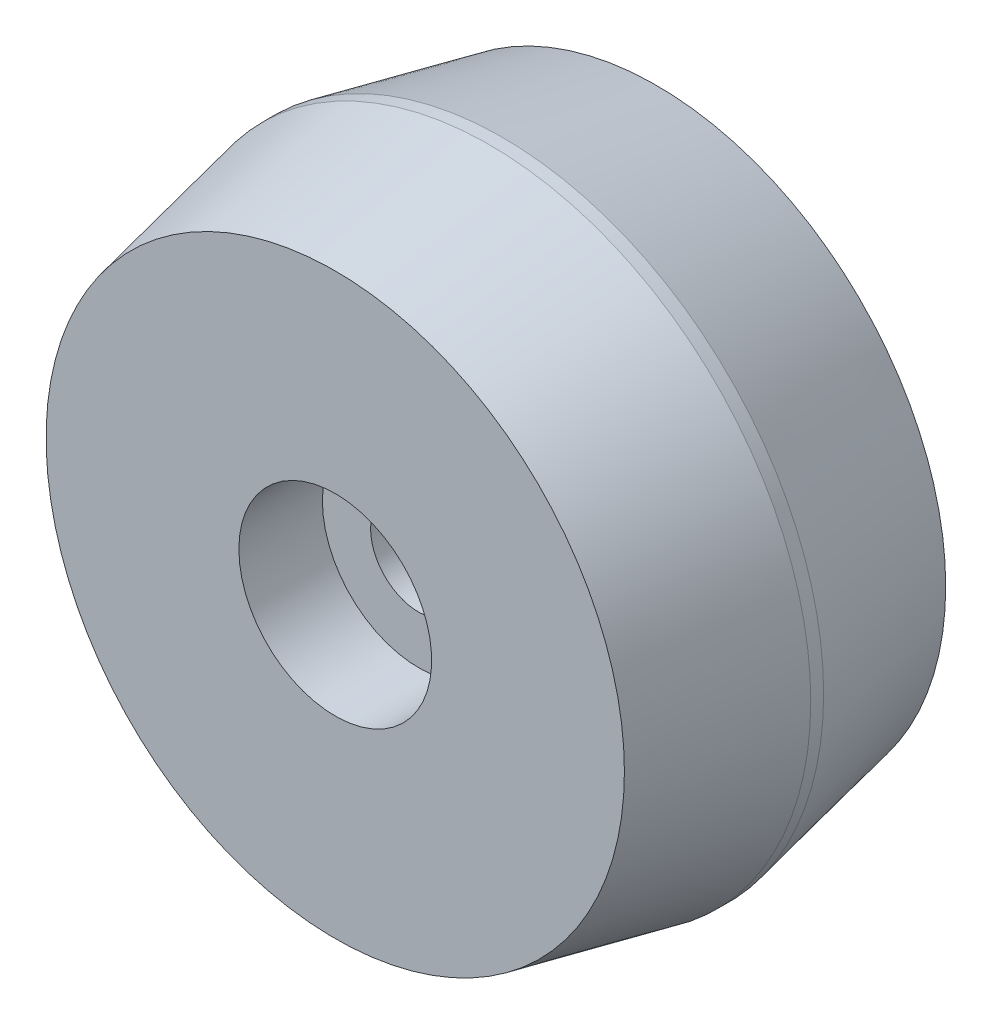
from build123d import *

# Parameters (mm, degrees)
SKETCH_1_R          = 10
EXTRUDE_1_DEPTH     = 10
CHAMFER_1_SIZE      = 1
CHAMFER_1_SIZE2     = 4.8
CHAMFER_2_SIZE      = 4.8
CHAMFER_2_SIZE2     = 1
SKETCH_2_R          = 3
CUT_EXTRUDE_1_DEPTH = 2.6
CUT_EXTRUDE_START   = -7.4
SKETCH_2_3_R        = 3
CUT_EXTRUDE_2_DEPTH = 2.6
SKETCH_4_R          = 1.5
CUT_EXTRUDE_3_DEPTH = 16.961202962


with BuildPart() as part:
    # 草图1 → 凸台-拉伸1 (new body)
    with BuildSketch(Plane.XY):
        Circle(SKETCH_1_R)
    extrude(amount=EXTRUDE_1_DEPTH)

    # 倒角1
    chamfer_1_edges = [part.edges().sort_by_distance(p)[0] for p in [
        (-10, 0, 0),
    ]]
    chamfer_1_side = [part.faces().sort_by_distance(p)[0] for p in [
        (0, 0, 0),
    ]]
    chamfer(chamfer_1_edges, length=CHAMFER_1_SIZE, length2=CHAMFER_1_SIZE2, reference=chamfer_1_side[0])

    # 倒角2
    chamfer_2_edges = [part.edges().sort_by_distance(p)[0] for p in [
        (-10, 0, 10),
    ]]
    chamfer_2_side = [part.faces().sort_by_distance(p)[0] for p in [
        (-10, 0, 7.4),
    ]]
    chamfer(chamfer_2_edges, length=CHAMFER_2_SIZE, length2=CHAMFER_2_SIZE2, reference=chamfer_2_side[0])

    # 草图2 → 切除-拉伸1 (cut)
    with BuildSketch(Plane(origin=(0, 0, 0), x_dir=(-1, 0, 0), z_dir=(0, 0, -1))):
        Circle(SKETCH_2_R)
    extrude(amount=-CUT_EXTRUDE_1_DEPTH, mode=Mode.SUBTRACT)

    # 草图2<3> → 切除-拉伸2 (cut)
    with BuildSketch(Plane(origin=(0, 0, 0), x_dir=(-1, 0, 0), z_dir=(0, 0, -1)).offset(CUT_EXTRUDE_START)):
        Circle(SKETCH_2_3_R)
    extrude(amount=-CUT_EXTRUDE_2_DEPTH, mode=Mode.SUBTRACT)

    # 草图4 → 切除-拉伸3 (cut, through all)
    with BuildSketch(Plane(origin=(0, 0, 2.6), x_dir=(-1, 0, 0), z_dir=(0, 0, -1))):
        Circle(SKETCH_4_R)
    extrude(amount=-CUT_EXTRUDE_3_DEPTH, mode=Mode.SUBTRACT)


solid = part.part
